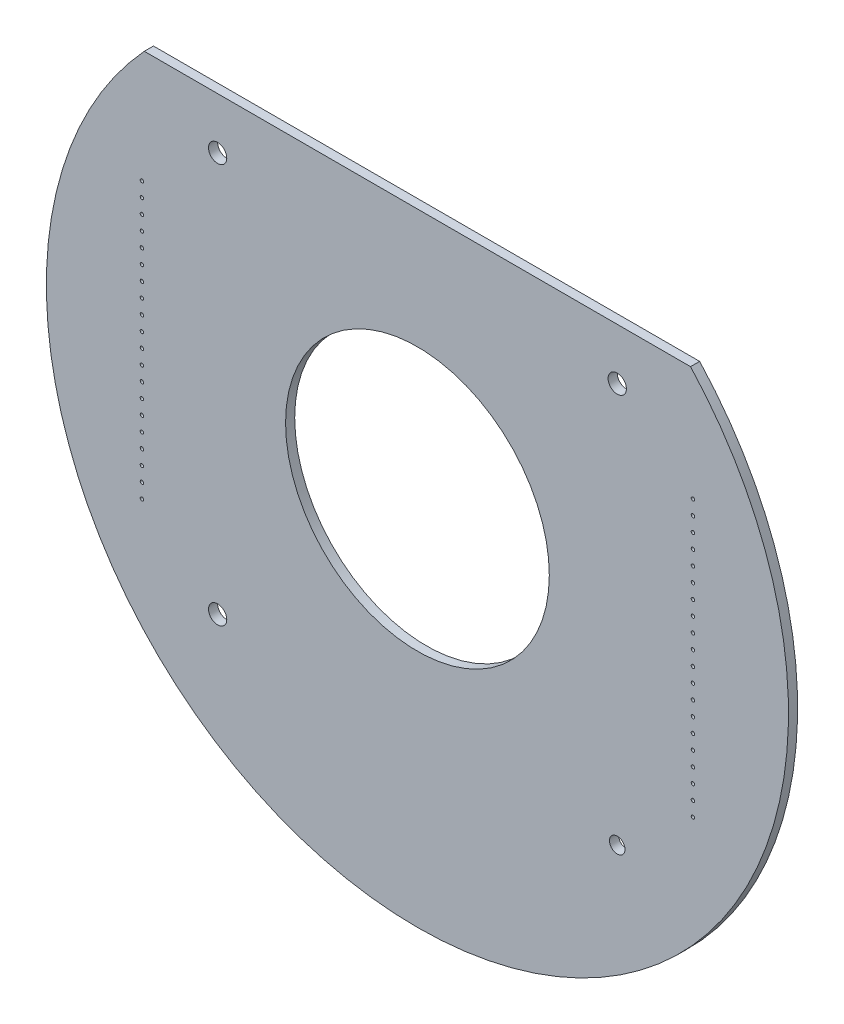
from build123d import *

# Parameters (mm, degrees)
SKETCH1_R           = 65
BOSS_EXTRUDE1_DEPTH = 1.6
SKETCH3_R           = 0.3
CUT_EXTRUDE1_DEPTH  = 1.6
SKETCH4_W           = 100
SKETCH4_H           = 26
CUT_EXTRUDE2_DEPTH  = 10
SKETCH5_R           = 1.6
SKETCH5_R_2         = 1.36
CUT_EXTRUDE3_DEPTH  = 10
SKETCH6_R           = 23.1
CUT_EXTRUDE4_DEPTH  = 1.6


with BuildPart() as part:
    # Sketch1 → Boss-Extrude1 (new body)
    with BuildSketch(Plane.XY):
        Circle(SKETCH1_R)
    extrude(amount=BOSS_EXTRUDE1_DEPTH)

    # Sketch3 → Cut-Extrude1 (cut)
    with BuildSketch(Plane.XY.offset(1.6)):
        with Locations((48.26, -24.130008683)):
            Circle(SKETCH3_R)
        with Locations((-48.26, -24.130008683)):
            Circle(SKETCH3_R)
        with Locations((-48.26, -21.590008683)):
            Circle(SKETCH3_R)
        with Locations((48.26, -21.590008683)):
            Circle(SKETCH3_R)
        with Locations((-48.26, -19.050008683)):
            Circle(SKETCH3_R)
        with Locations((48.26, -19.050008683)):
            Circle(SKETCH3_R)
        with Locations((-48.26, -16.510008683)):
            Circle(SKETCH3_R)
        with Locations((48.26, -16.510008683)):
            Circle(SKETCH3_R)
        with Locations((-48.26, -13.970008683)):
            Circle(SKETCH3_R)
        with Locations((48.26, -13.970008683)):
            Circle(SKETCH3_R)
        with Locations((-48.26, -11.430008683)):
            Circle(SKETCH3_R)
        with Locations((48.26, -11.430008683)):
            Circle(SKETCH3_R)
        with Locations((-48.26, -8.890008683)):
            Circle(SKETCH3_R)
        with Locations((48.26, -8.890008683)):
            Circle(SKETCH3_R)
        with Locations((-48.26, -6.350008683)):
            Circle(SKETCH3_R)
        with Locations((48.26, -6.350008683)):
            Circle(SKETCH3_R)
        with Locations((-48.26, -3.810008683)):
            Circle(SKETCH3_R)
        with Locations((48.26, -3.810008683)):
            Circle(SKETCH3_R)
        with Locations((-48.26, -1.270008683)):
            Circle(SKETCH3_R)
        with Locations((48.26, -1.270008683)):
            Circle(SKETCH3_R)
        with Locations((-48.26, 1.269991317)):
            Circle(SKETCH3_R)
        with Locations((48.26, 1.269991317)):
            Circle(SKETCH3_R)
        with Locations((-48.26, 3.809991317)):
            Circle(SKETCH3_R)
        with Locations((48.26, 3.809991317)):
            Circle(SKETCH3_R)
        with Locations((-48.26, 6.349991317)):
            Circle(SKETCH3_R)
        with Locations((48.26, 6.349991317)):
            Circle(SKETCH3_R)
        with Locations((-48.26, 8.889991317)):
            Circle(SKETCH3_R)
        with Locations((48.26, 8.889991317)):
            Circle(SKETCH3_R)
        with Locations((-48.26, 11.429991317)):
            Circle(SKETCH3_R)
        with Locations((48.26, 11.429991317)):
            Circle(SKETCH3_R)
        with Locations((-48.26, 13.969991317)):
            Circle(SKETCH3_R)
        with Locations((48.26, 13.969991317)):
            Circle(SKETCH3_R)
        with Locations((-48.26, 16.509991317)):
            Circle(SKETCH3_R)
        with Locations((48.26, 16.509991317)):
            Circle(SKETCH3_R)
        with Locations((-48.26, 19.049991317)):
            Circle(SKETCH3_R)
        with Locations((48.26, 19.049991317)):
            Circle(SKETCH3_R)
        with Locations((-48.26, 21.589991317)):
            Circle(SKETCH3_R)
        with Locations((48.26, 21.589991317)):
            Circle(SKETCH3_R)
        with Locations((-48.26, 24.129991317)):
            Circle(SKETCH3_R)
        with Locations((48.26, 24.129991317)):
            Circle(SKETCH3_R)
    extrude(amount=-CUT_EXTRUDE1_DEPTH, mode=Mode.SUBTRACT)

    # Sketch4 → Cut-Extrude2 (cut)
    with BuildSketch(Plane.XY.offset(1.6)):
        with Locations((0, 57)):
            Rectangle(SKETCH4_W, SKETCH4_H)
    extrude(amount=-CUT_EXTRUDE2_DEPTH, mode=Mode.SUBTRACT)

    # Sketch5 → Cut-Extrude3 (cut)
    with BuildSketch(Plane.XY.offset(1.6)):
        with Locations((-35, 35)):
            Circle(SKETCH5_R)
        with Locations((35, 35)):
            Circle(SKETCH5_R)
        with Locations((-35, -35)):
            Circle(SKETCH5_R)
        with Locations((35, -35)):
            Circle(SKETCH5_R_2)
    extrude(amount=-CUT_EXTRUDE3_DEPTH, mode=Mode.SUBTRACT)

    # Sketch6 → Cut-Extrude4 (cut)
    with BuildSketch(Plane.XY.offset(1.6)):
        Circle(SKETCH6_R)
    extrude(amount=-CUT_EXTRUDE4_DEPTH, mode=Mode.SUBTRACT)


solid = part.part
